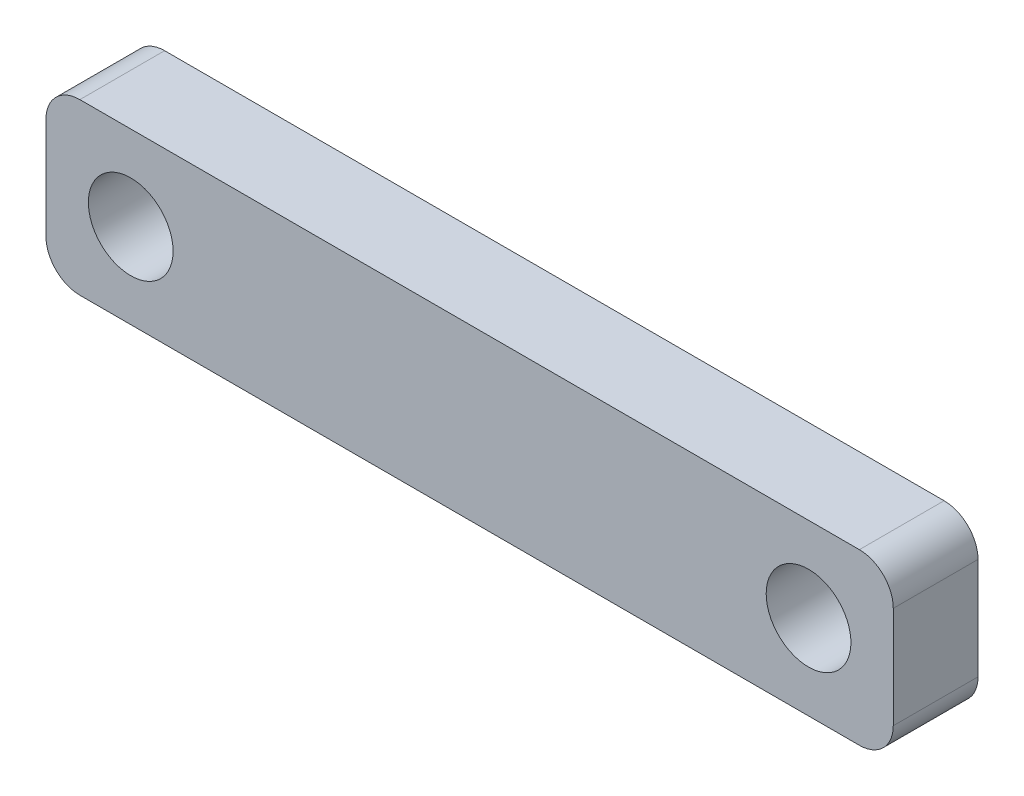
from build123d import *

# Parameters (mm, degrees)
ESQUISSE1_W        = 50
ESQUISSE1_H        = 10
ESQUISSE1_R        = 2.5
BOSS_EXTRU_1_DEPTH = 5
CONG_1_R           = 2
CONG_2_R           = 2
CONG_3_R           = 2
CONG_4_R           = 2


with BuildPart() as part:
    # Esquisse1 → Boss.-Extru.1 (new body)
    with BuildSketch(Plane.XY):
        with Locations((8.658413849, 3.369565217)):
            Rectangle(ESQUISSE1_W, ESQUISSE1_H)
        with Locations((-11.341586151, 3.369565217)):
            Circle(ESQUISSE1_R, mode=Mode.SUBTRACT)
        with Locations(Location((28.658413849, 3.369565217, 0), (0, 0, 180))):
            Circle(ESQUISSE1_R, mode=Mode.SUBTRACT)
    extrude(amount=BOSS_EXTRU_1_DEPTH)

    # Congé1
    cong_1_edges = [part.edges().sort_by_distance(p)[0] for p in [
        (-16.341586151, 8.369565217, 2.5),
    ]]
    fillet(cong_1_edges, radius=CONG_1_R)

    # Congé2
    cong_2_edges = [part.edges().sort_by_distance(p)[0] for p in [
        (-16.341586151, -1.630434783, 2.5),
    ]]
    fillet(cong_2_edges, radius=CONG_2_R)

    # Congé3
    cong_3_edges = [part.edges().sort_by_distance(p)[0] for p in [
        (33.658413849, 8.369565217, 2.5),
    ]]
    fillet(cong_3_edges, radius=CONG_3_R)

    # Congé4
    cong_4_edges = [part.edges().sort_by_distance(p)[0] for p in [
        (33.658413849, -1.630434783, 2.5),
    ]]
    fillet(cong_4_edges, radius=CONG_4_R)


solid = part.part
